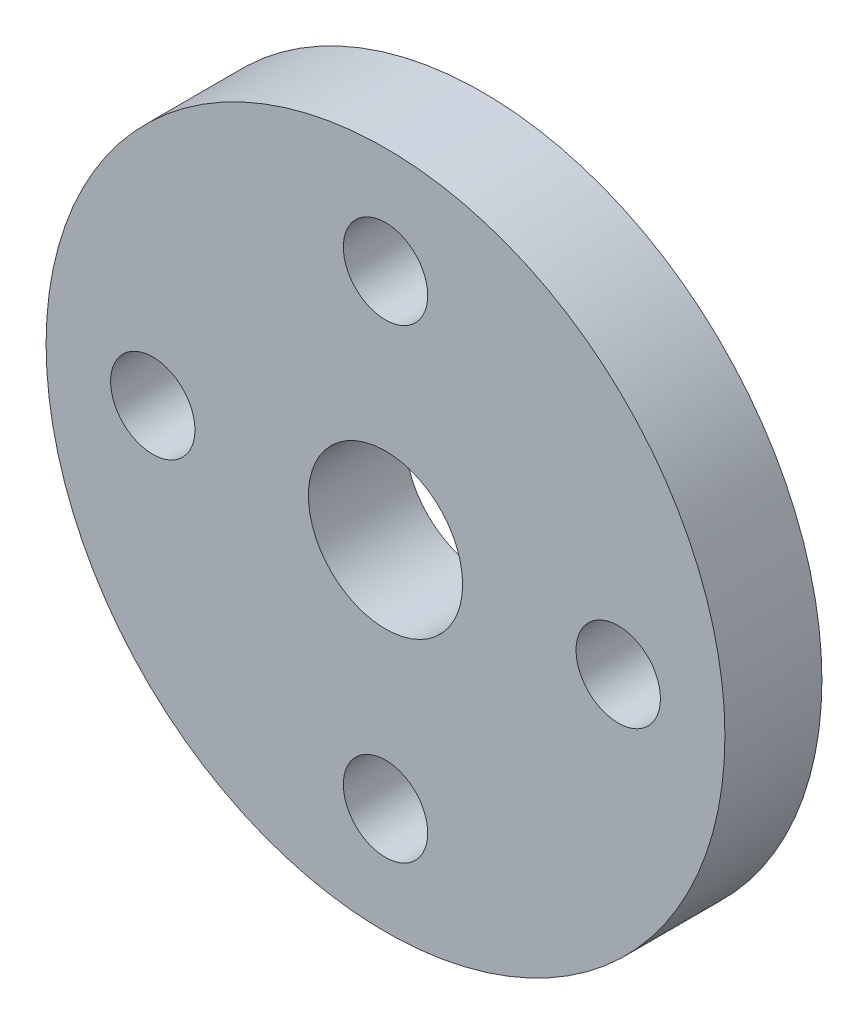
from build123d import *

# Parameters (mm, degrees)
SKETCH1_R           = 17.5
SKETCH1_R_2         = 2.175
SKETCH1_R_3         = 3.975
BOSS_EXTRUDE1_DEPTH = 5


with BuildPart() as part:
    # Sketch1 → Boss-Extrude1 (new body)
    with BuildSketch(Plane.XY):
        Circle(SKETCH1_R)
        with Locations((12, 0)):
            Circle(SKETCH1_R_2, mode=Mode.SUBTRACT)
        with Locations((0, 12)):
            Circle(SKETCH1_R_2, mode=Mode.SUBTRACT)
        with Locations((-12, 0)):
            Circle(SKETCH1_R_2, mode=Mode.SUBTRACT)
        with Locations((0, -12)):
            Circle(SKETCH1_R_2, mode=Mode.SUBTRACT)
        Circle(SKETCH1_R_3, mode=Mode.SUBTRACT)
    extrude(amount=BOSS_EXTRUDE1_DEPTH)


solid = part.part
